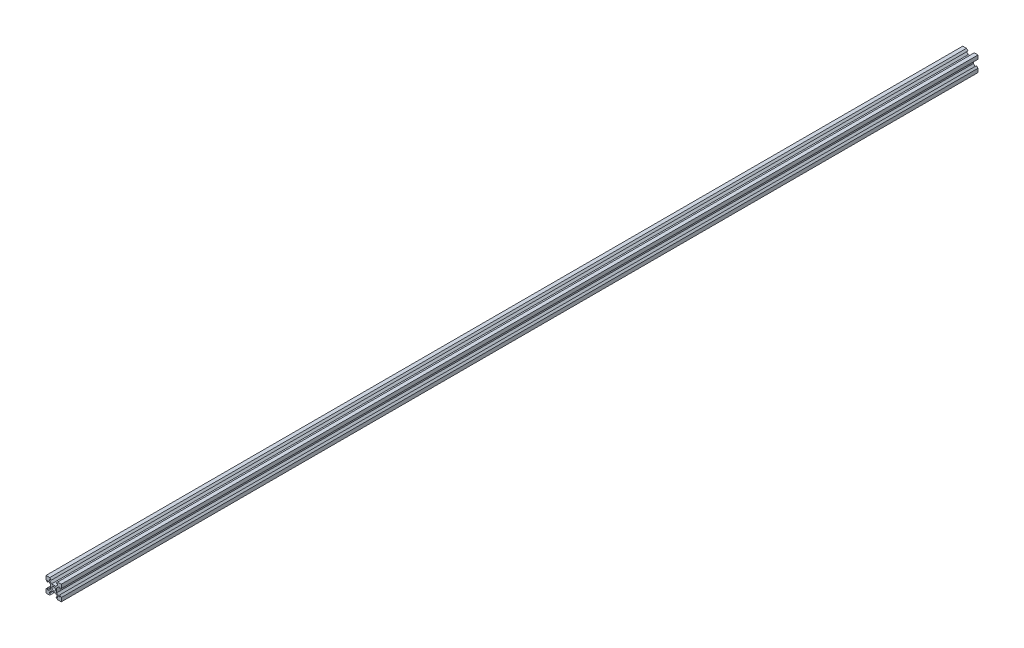
from build123d import *

# Parameters (mm, degrees)
SKETCH1_R           = 2.5
BOSS_EXTRUDE1_DEPTH = 1200


with BuildPart() as part:
    # Sketch1 → Boss-Extrude1 (new body)
    with BuildSketch(Plane.XY):
        Polygon((-2.727207794, 4), (2.727207794, 4), (5.3, 6.572792206), (5.3, 8), (3.1, 8), (5.1, 10), (10, 10), (10, 5.1), (8, 3.1), (8, 5.3), (6.572792206, 5.3), (4, 2.727207794), (4, -2.727207794), (6.572792206, -5.3), (8, -5.3), (8, -3.1), (10, -5.1), (10, -10), (5.1, -10), (3.1, -8), (5.3, -8), (5.3, -6.572792206), (2.727207794, -4), (-2.727207794, -4), (-5.3, -6.572792206), (-5.3, -8), (-3.1, -8), (-5.1, -10), (-10, -10), (-10, -5.1), (-8, -3.1), (-8, -5.3), (-6.572792206, -5.3), (-4, -2.727207794), (-4, 2.727207794), (-6.572792206, 5.3), (-8, 5.3), (-8, 3.1), (-10, 5.1), (-10, 10), (-5.1, 10), (-3.1, 8), (-5.3, 8), (-5.3, 6.572792206), align=None)
        Circle(SKETCH1_R, mode=Mode.SUBTRACT)
    extrude(amount=BOSS_EXTRUDE1_DEPTH)


solid = part.part
